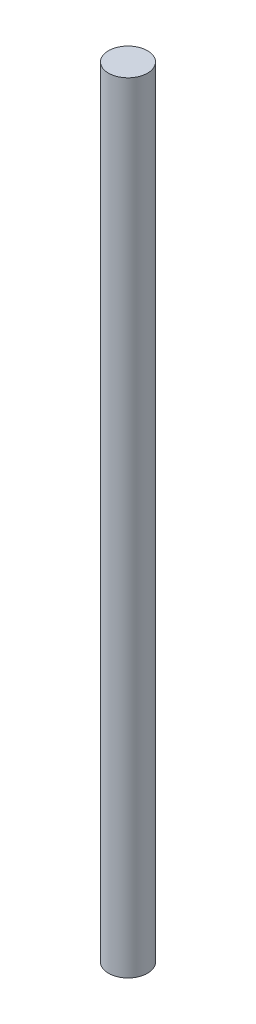
from build123d import *

# Parameters (mm, degrees)
SKETCH_1_R      = 1.75
EXTRUDE_1_DEPTH = 70


with BuildPart() as part:
    # 草圖1 → 填料-伸長1 (new body)
    with BuildSketch(Plane(origin=(0, 0, 0), x_dir=(1, 0, 0), z_dir=(0, 1, 0))):
        with Locations(Location((0, 0, 0), (0, 0, 270))):
            Circle(SKETCH_1_R)
    extrude(amount=EXTRUDE_1_DEPTH)


solid = part.part
